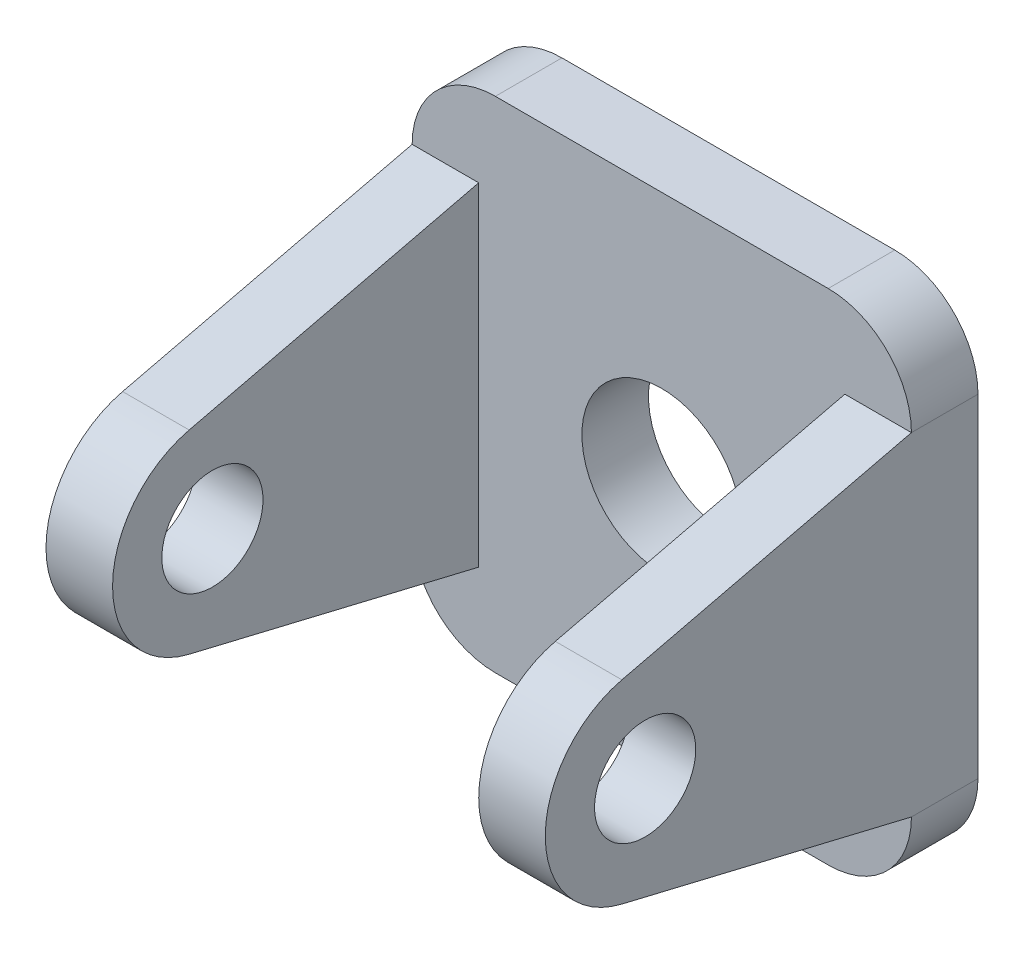
from build123d import *

# Parameters (mm, degrees)
BOSS_EXTRUDE1_DEPTH = 10
SKETCH2_R           = 7.6
BOSS_EXTRUDE2_DEPTH = 10
SKETCH4_R           = 12
CUT_EXTRUDE2_DEPTH  = 77.40353395


with BuildPart() as part:
    # Sketch1 → Boss-Extrude1 (new body)
    with BuildSketch(Plane(origin=(0, 0, 0), x_dir=(0, 1, 0), z_dir=(0, 0, 1))):
        with BuildLine():
            Line((-25, -37.5), (25, -37.5))
            ThreePointArc((25, -37.5), (33.838834765, -33.838834765), (37.5, -25))
            Line((37.5, -25), (37.5, 25))
            ThreePointArc((37.5, 25), (33.838834765, 33.838834765), (25, 37.5))
            Line((25, 37.5), (-25, 37.5))
            ThreePointArc((-25, 37.5), (-33.838834765, 33.838834765), (-37.5, 25))
            Line((-37.5, 25), (-37.5, -25))
            ThreePointArc((-37.5, -25), (-33.838834765, -33.838834765), (-25, -37.5))
        make_face()
    extrude(amount=BOSS_EXTRUDE1_DEPTH)

    # Sketch2 → Boss-Extrude2 (add)
    with BuildSketch(Plane.YZ.offset(37.5)):
        with BuildLine():
            ThreePointArc((14.587782351, 53.492363969), (0, 65), (-14.587782351, 53.492363969))
            Line((-14.587782351, 53.492363969), (-25, 10))
            Line((-25, 10), (25, 10))
            Line((25, 10), (14.587782351, 53.492363969))
        make_face()
        with Locations(Location((0, 50, 0), (0, 0, 270))):
            Circle(SKETCH2_R, mode=Mode.SUBTRACT)
    boss_extrude2 = extrude(amount=-BOSS_EXTRUDE2_DEPTH)

    # Mirror1: Boss-Extrude2 across plane
    add(boss_extrude2.mirror(Plane(origin=(0, 0, 0), x_dir=(0, 0, 1), z_dir=(1, 0, 0))))

    # Sketch4 → Cut-Extrude2 (cut, through all)
    with BuildSketch(Plane.XY.offset(10)):
        Circle(SKETCH4_R)
    extrude(amount=-CUT_EXTRUDE2_DEPTH, mode=Mode.SUBTRACT)


solid = part.part
